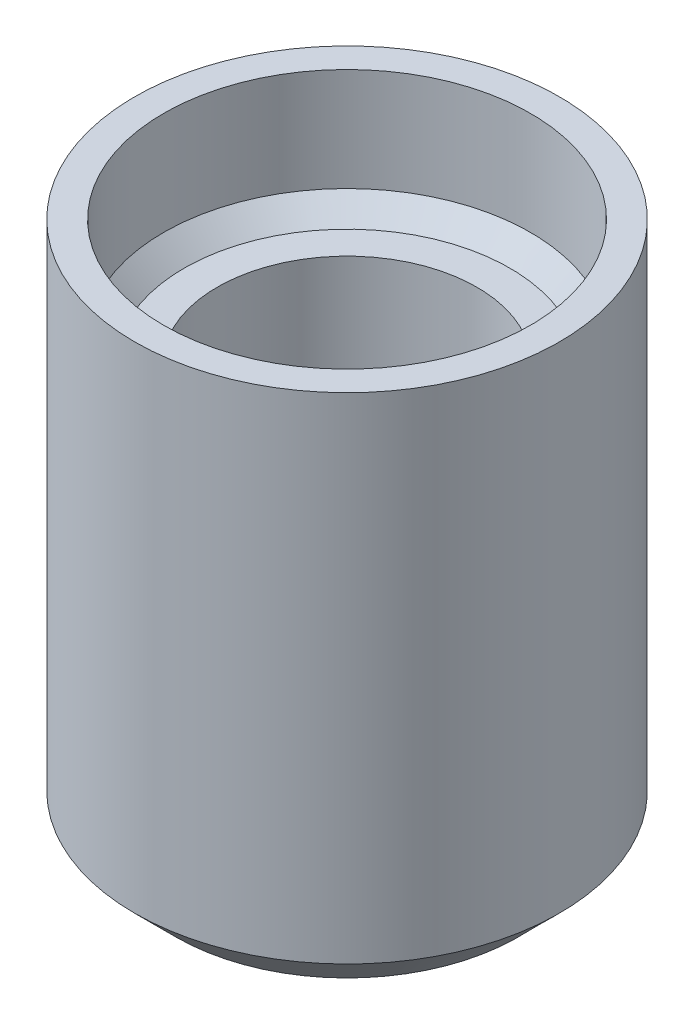
from build123d import *

# Parameters (mm, degrees)
SKETCH1_R           = 5.15
BOSS_EXTRUDE1_DEPTH = 10
SKETCH2_R           = 5.15
BOSS_EXTRUDE2_DEPTH = 2
SKETCH4_R           = 5.15
SKETCH4_R_2         = 4.45
BOSS_EXTRUDE3_DEPTH = 3
CHAMFER1_SIZE       = 1
CHAMFER2_SIZE       = 0.5


with BuildPart() as part:
    # Sketch1 → Boss-Extrude1 (new body)
    with BuildSketch(Plane(origin=(0, 0, 0), x_dir=(1, 0, 0), z_dir=(0, 1, 0))):
        with Locations(Location((0, 0, 0), (0, 0, 270))):
            Circle(SKETCH1_R)
        with BuildLine():
            Line((2.683281573, -1.65), (-2.683281573, -1.65))
            ThreePointArc((-2.683281573, -1.65), (0, 3.15), (2.683281573, -1.65))
        make_face(mode=Mode.SUBTRACT)
    extrude(amount=BOSS_EXTRUDE1_DEPTH)

    # Sketch2 → Boss-Extrude2 (add)
    with BuildSketch(Plane.XZ):
        with Locations(Location((0, 0, 0), (0, 0, 90))):
            Circle(SKETCH2_R)
    extrude(amount=-BOSS_EXTRUDE2_DEPTH)

    # Sketch4 → Boss-Extrude3 (add)
    with BuildSketch(Plane(origin=(0, 10, 0), x_dir=(1, 0, 0), z_dir=(0, 1, 0))):
        with Locations(Location((0, 0, 0), (0, 0, 270))):
            Circle(SKETCH4_R)
        with Locations(Location((0, 0, 0), (0, 0, 270))):
            Circle(SKETCH4_R_2, mode=Mode.SUBTRACT)
    extrude(amount=BOSS_EXTRUDE3_DEPTH)

    # Chamfer1
    chamfer1_edges = [part.edges().sort_by_distance(p)[0] for p in [
        (0, 0, -5.15),
    ]]
    chamfer(chamfer1_edges, length=CHAMFER1_SIZE)

    # Chamfer2
    chamfer2_edges = [part.edges().sort_by_distance(p)[0] for p in [
        (0, 10, -4.45),
    ]]
    chamfer(chamfer2_edges, length=CHAMFER2_SIZE)


solid = part.part
